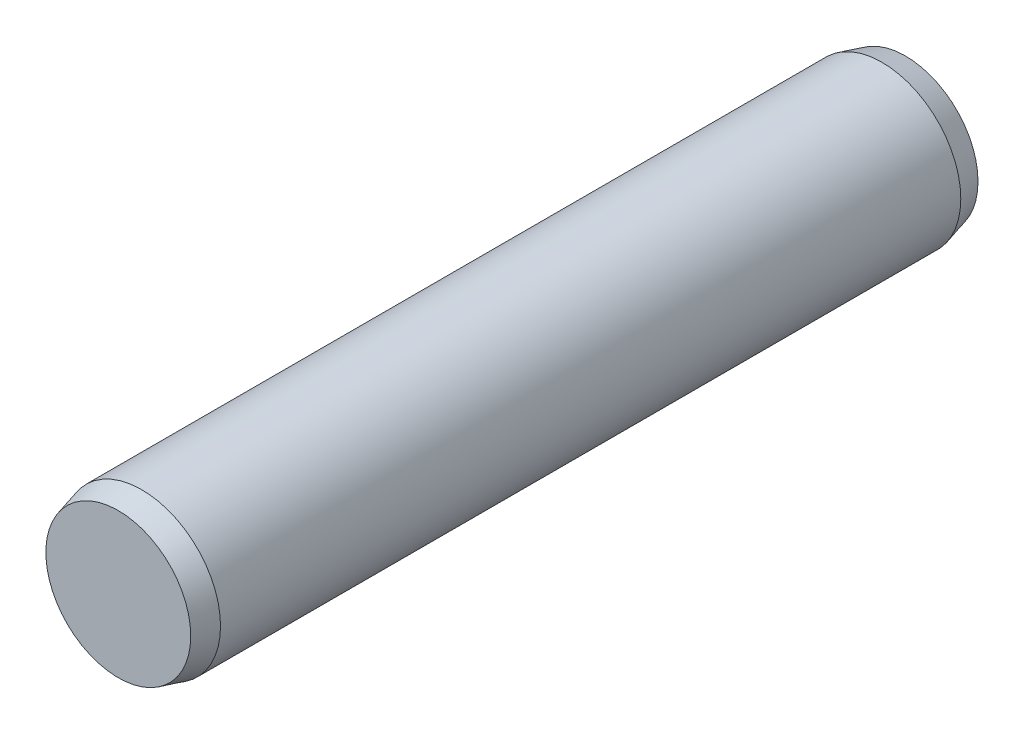
from build123d import *

# Parameters (mm, degrees)
SKETCH_1_R      = 2.5
EXTRUDE_1_DEPTH = 12.5
CHAMFER_1_SIZE  = 0.2
CHAMFER_1_SIZE2 = 0.746410162
CHAMFER_2_SIZE  = 0.2
CHAMFER_2_SIZE2 = 0.746410162


with BuildPart() as part:
    # 草图1 → 凸台-拉伸1 (new, symmetric)
    with BuildSketch(Plane.XY):
        Circle(SKETCH_1_R)
    extrude(amount=EXTRUDE_1_DEPTH, both=True)

    # 倒角1
    chamfer_1_edges = [part.edges().sort_by_distance(p)[0] for p in [
        (-2.5, 0, 12.5),
    ]]
    chamfer_1_side = [part.faces().sort_by_distance(p)[0] for p in [
        (0, 0, 12.5),
    ]]
    chamfer(chamfer_1_edges, length=CHAMFER_1_SIZE, length2=CHAMFER_1_SIZE2, reference=chamfer_1_side[0])

    # 倒角2
    chamfer_2_edges = [part.edges().sort_by_distance(p)[0] for p in [
        (-2.5, 0, -12.5),
    ]]
    chamfer_2_side = [part.faces().sort_by_distance(p)[0] for p in [
        (0, 0, -12.5),
    ]]
    chamfer(chamfer_2_edges, length=CHAMFER_2_SIZE, length2=CHAMFER_2_SIZE2, reference=chamfer_2_side[0])


solid = part.part
